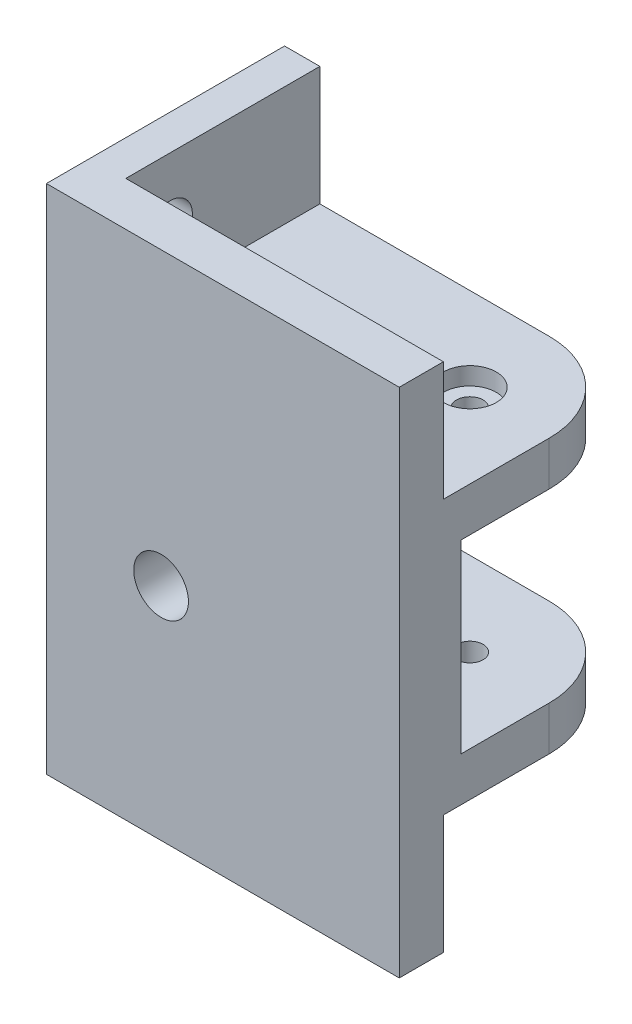
from build123d import *

# Parameters (mm, degrees)
EXTRUDE_1_DEPTH      = 58
SKETCH_2_R           = 3
CUT_EXTRUDE_1_DEPTH  = 58
SKETCH_3_W           = 15
SKETCH_3_H           = 14.5
SKETCH_3_W_2         = 25
CUT_EXTRUDE_2_DEPTH  = 22
SKETCH_5_W           = 4
SKETCH_5_H           = 14.5
EXTRUDE_2_DEPTH      = 22
CUT_EXTRUDE_3_DEPTH  = 22
CUT_EXTRUDE_START    = -30
CUT_EXTRUDE_4_DEPTH  = 30
EXTRUDE_START        = -4
EXTRUDE_5_DEPTH      = 4
EXTRUDE_6_DEPTH      = 4
SKETCH_18_R          = 3.05
CUT_EXTRUDE_7_DEPTH  = 50
SKETCH_17_R          = 1.51
CUT_EXTRUDE_8_DEPTH  = 50
EXTRUDE_7_DEPTH      = 4
EXTRUDE_START_2      = 1
SKETCH_20_R          = 1.51
EXTRUDE_8_DEPTH      = 1
SKETCH_21_R          = 3
SKETCH_21_R_2        = 1.51
CUT_EXTRUDE_9_DEPTH  = 2
EXTRUDE_9_DEPTH      = 4
SKETCH_23_R          = 1.51
EXTRUDE_10_DEPTH     = 1
CUT_EXTRUDE_START_2  = -2
SKETCH_24_R          = 3
CUT_EXTRUDE_10_DEPTH = 2
CUT_EXTRUDE_11_DEPTH = 100
SKETCH_26_R          = 3.05
EXTRUDE_11_DEPTH     = 27
SKETCH_27_R          = 3.1
CUT_EXTRUDE_12_DEPTH = 27
SKETCH_29_W          = 20
SKETCH_29_H          = 21
CUT_EXTRUDE_13_DEPTH = 20
EXTRUDE_START_3      = -5
SKETCH_30_R          = 3
EXTRUDE_12_DEPTH     = 5
SKETCH_32_R          = 3
EXTRUDE_13_DEPTH     = 5
SKETCH_34_R          = 1.51
CUT_EXTRUDE_14_DEPTH = 100
SKETCH_35_R          = 3
CUT_EXTRUDE_15_DEPTH = 2
SKETCH_36_R          = 3
CUT_EXTRUDE_16_DEPTH = 2


with BuildPart() as part:
    # 草图1 → 凸台-拉伸1 (new body)
    with BuildSketch(Plane(origin=(0, 0, 0), x_dir=(1, 0, 0), z_dir=(0, 1, 0))):
        with BuildLine():
            Line((-20, 13.5), (5, 13.5))
            ThreePointArc((5, 13.5), (15.606601718, 9.106601718), (20, -1.5))
            Line((20, -1.5), (20, -13.5))
            Line((20, -13.5), (-20, -13.5))
            Line((-20, -13.5), (-20, 13.5))
        make_face()
    extrude(amount=EXTRUDE_1_DEPTH)

    # 草图2 → 切除-拉伸1 (cut)
    with BuildSketch(Plane.XY.offset(13.5)):
        with Locations((-7, 33)):
            Circle(SKETCH_2_R)
    extrude(amount=-CUT_EXTRUDE_1_DEPTH, mode=Mode.SUBTRACT)

    # 草图3 → 切除-拉伸2 (cut)
    with BuildSketch(Plane(origin=(0, 0, -13.5), x_dir=(-1, 0, 0), z_dir=(0, 0, -1))):
        with Locations((-12.5, 50.75)):
            Rectangle(SKETCH_3_W, SKETCH_3_H)
        with Locations((-12.5, 7.25)):
            Rectangle(SKETCH_3_W, SKETCH_3_H)
        with Locations((7.5, 7.25)):
            Rectangle(SKETCH_3_W_2, SKETCH_3_H)
        with Locations((7.5, 50.75)):
            Rectangle(SKETCH_3_W_2, SKETCH_3_H)
    extrude(amount=-CUT_EXTRUDE_2_DEPTH, mode=Mode.SUBTRACT)

    # 草图5 → 凸台-拉伸2 (add)
    with BuildSketch(Plane(origin=(0, 0, 8.5), x_dir=(-1, 0, 0), z_dir=(0, 0, -1))):
        with Locations((18, 7.25)):
            Rectangle(SKETCH_5_W, SKETCH_5_H)
        with Locations((18, 50.75)):
            Rectangle(SKETCH_5_W, SKETCH_5_H)
    extrude(amount=EXTRUDE_2_DEPTH)

    # 草图8 → 切除-拉伸3 (cut)
    with BuildSketch(Plane.ZY.offset(20)):
        with BuildLine():
            ThreePointArc((6.05, 50.75), (5.303122292, 52.553122292), (3.5, 53.3))
            Line((3.5, 53.3), (3.5, 48.2))
            ThreePointArc((3.5, 48.2), (5.303122292, 48.946877708), (6.05, 50.75))
        make_face()
        with BuildLine():
            Line((3.5, 48.2), (3.5, 53.3))
            ThreePointArc((3.5, 53.3), (0.95, 50.75), (3.5, 48.2))
        make_face()
        with BuildLine():
            ThreePointArc((3.5, 9.8), (0.95, 7.25), (3.5, 4.7))
            Line((3.5, 4.7), (3.5, 9.8))
        make_face()
        with BuildLine():
            Line((3.5, 9.8), (3.5, 4.7))
            ThreePointArc((3.5, 4.7), (5.303122292, 5.446877708), (6.05, 7.25))
            ThreePointArc((6.05, 7.25), (5.303122292, 9.053122292), (3.5, 9.8))
        make_face()
    extrude(amount=-CUT_EXTRUDE_3_DEPTH, mode=Mode.SUBTRACT)

    # 草图10 → 切除-拉伸4 (cut)
    with BuildSketch(Plane(origin=(0, 43.5, 0), x_dir=(1, 0, 0), z_dir=(0, 1, 0)).offset(CUT_EXTRUDE_START)):
        with BuildLine():
            Line((20, -6.5), (20, -1.5))
            ThreePointArc((20, -1.5), (15.606601718, 9.106601718), (5, 13.5))
            Line((5, 13.5), (0, 13.5))
            ThreePointArc((0, 13.5), (5.857864376, -0.642135624), (20, -6.5))
        make_face()
        with BuildLine():
            Line((20, -1.5), (20, 13.5))
            Line((20, 13.5), (5, 13.5))
            ThreePointArc((5, 13.5), (15.606601718, 9.106601718), (20, -1.5))
        make_face()
    extrude(amount=CUT_EXTRUDE_4_DEPTH, mode=Mode.SUBTRACT)

    # 草图11 → 凸台-拉伸5 (add)
    with BuildSketch(Plane(origin=(0, 43.5, 0), x_dir=(1, 0, 0), z_dir=(0, 1, 0)).offset(EXTRUDE_START)):
        with BuildLine():
            Line((5, 13.5), (0, 13.5))
            ThreePointArc((0, 13.5), (5.857864376, -0.642135624), (20, -6.5))
            Line((20, -6.5), (20, -1.5))
            ThreePointArc((20, -1.5), (15.606601718, 9.106601718), (5, 13.5))
        make_face()
    extrude(amount=EXTRUDE_5_DEPTH)

    # 草图13 → 凸台-拉伸6 (add)
    with BuildSketch(Plane.XZ.offset(-14.5)):
        with BuildLine():
            Line((0, -13.5), (5, -13.5))
            ThreePointArc((5, -13.5), (15.606601718, -9.106601718), (20, 1.5))
            Line((20, 1.5), (20, 6.5))
            ThreePointArc((20, 6.5), (5.857864376, 0.642135624), (0, -13.5))
        make_face()
    extrude(amount=-EXTRUDE_6_DEPTH)

    # 草图18 → 切除-拉伸7 (cut)
    with BuildSketch(Plane.XY.offset(13.5)):
        with Locations((-7, 33)):
            Circle(SKETCH_18_R)
    extrude(amount=-CUT_EXTRUDE_7_DEPTH, mode=Mode.SUBTRACT)

    # 草图17 → 切除-拉伸8 (cut)
    with BuildSketch(Plane(origin=(0, 43.5, 0), x_dir=(1, 0, 0), z_dir=(0, 1, 0))):
        with Locations(Location((12.928932188, 6.428932188, 0), (0, 0, 270))):
            Circle(SKETCH_17_R)
    extrude(amount=-CUT_EXTRUDE_8_DEPTH, mode=Mode.SUBTRACT)

    # 草图19 → 凸台-拉伸7 (add)
    with BuildSketch(Plane(origin=(0, 43.5, 0), x_dir=(1, 0, 0), z_dir=(0, 1, 0)).offset(EXTRUDE_START)):
        with BuildLine():
            Line((10, 13.5), (5, 13.5))
            ThreePointArc((5, 13.5), (15.606601718, 9.106601718), (20, -1.5))
            Line((20, -1.5), (20, 3.5))
            ThreePointArc((20, 3.5), (17.071067812, 10.571067812), (10, 13.5))
        make_face()
    extrude(amount=EXTRUDE_7_DEPTH)

    # 草图20 → 凸台-拉伸8 (add)
    with BuildSketch(Plane(origin=(0, 43.5, 0), x_dir=(1, 0, 0), z_dir=(0, 1, 0)).offset(EXTRUDE_START_2)):
        with BuildLine():
            Line((20, 3.5), (20, -8.5))
            Line((20, -8.5), (-16, -8.5))
            Line((-16, -8.5), (-16, 13.5))
            Line((-16, 13.5), (10, 13.5))
            ThreePointArc((10, 13.5), (17.071067812, 10.571067812), (20, 3.5))
        make_face()
        with Locations(Location((12.928932188, 6.428932188, 0), (0, 0, 270))):
            Circle(SKETCH_20_R, mode=Mode.SUBTRACT)
    extrude(amount=-EXTRUDE_8_DEPTH)

    # 草图21 → 切除-拉伸9 (cut)
    with BuildSketch(Plane(origin=(0, 44.5, 0), x_dir=(1, 0, 0), z_dir=(0, 1, 0))):
        with Locations(Location((12.928932188, 6.428932188, 0), (0, 0, 270))):
            Circle(SKETCH_21_R)
        with Locations(Location((12.928932188, 6.428932188, 0), (0, 0, 270))):
            Circle(SKETCH_21_R_2, mode=Mode.SUBTRACT)
    extrude(amount=-CUT_EXTRUDE_9_DEPTH, mode=Mode.SUBTRACT)

    # 草图22 → 凸台-拉伸9 (add)
    with BuildSketch(Plane(origin=(0, 14.5, 0), x_dir=(-1, 0, 0), z_dir=(0, -1, 0))):
        with BuildLine():
            Line((-5, 13.5), (-10, 13.5))
            ThreePointArc((-10, 13.5), (-17.071067812, 10.571067812), (-20, 3.5))
            Line((-20, 3.5), (-20, -1.5))
            ThreePointArc((-20, -1.5), (-15.606601718, 9.106601718), (-5, 13.5))
        make_face()
    extrude(amount=-EXTRUDE_9_DEPTH)

    # 草图23 → 凸台-拉伸10 (add)
    with BuildSketch(Plane(origin=(0, 14.5, 0), x_dir=(-1, 0, 0), z_dir=(0, -1, 0))):
        with BuildLine():
            Line((16, -8.5), (16, 13.5))
            Line((16, 13.5), (-10, 13.5))
            ThreePointArc((-10, 13.5), (-17.071067812, 10.571067812), (-20, 3.5))
            Line((-20, 3.5), (-20, -8.5))
            Line((-20, -8.5), (16, -8.5))
        make_face()
        with Locations(Location((-12.928932188, 6.428932188, 0), (0, 0, 270))):
            Circle(SKETCH_23_R, mode=Mode.SUBTRACT)
    extrude(amount=EXTRUDE_10_DEPTH)

    # 草图24 → 切除-拉伸10 (cut)
    with BuildSketch(Plane(origin=(0, 13.5, 0), x_dir=(-1, 0, 0), z_dir=(0, -1, 0)).offset(CUT_EXTRUDE_START_2)):
        with Locations(Location((-12.928932188, 6.428932188, 0), (0, 0, 270))):
            Circle(SKETCH_24_R)
    extrude(amount=CUT_EXTRUDE_10_DEPTH, mode=Mode.SUBTRACT)

    # 草图25 → 切除-拉伸11 (cut)
    with BuildSketch(Plane.XY.offset(13.5)):
        with BuildLine():
            ThreePointArc((-3.95, 25), (-4.843324317, 27.156675683), (-7, 28.05))
            Line((-7, 28.05), (-7, 21.95))
            ThreePointArc((-7, 21.95), (-4.843324317, 22.843324317), (-3.95, 25))
        make_face()
        with BuildLine():
            Line((-7, 21.95), (-7, 28.05))
            ThreePointArc((-7, 28.05), (-10.05, 25), (-7, 21.95))
        make_face()
    extrude(amount=-CUT_EXTRUDE_11_DEPTH, mode=Mode.SUBTRACT)

    # 草图26 → 凸台-拉伸11 (add)
    with BuildSketch(Plane.XY.offset(13.5)):
        with Locations((-7, 33)):
            Circle(SKETCH_26_R)
    extrude(amount=-EXTRUDE_11_DEPTH)

    # 草图27 → 切除-拉伸12 (cut)
    with BuildSketch(Plane.XY.offset(13.5)):
        with Locations((-7, 25)):
            Circle(SKETCH_27_R)
    extrude(amount=-CUT_EXTRUDE_12_DEPTH, mode=Mode.SUBTRACT)

    # 草图29 → 切除-拉伸13 (cut)
    with BuildSketch(Plane(origin=(0, 0, -13.5), x_dir=(-1, 0, 0), z_dir=(0, 0, -1))):
        with Locations((-10, 29)):
            Rectangle(SKETCH_29_W, SKETCH_29_H)
    extrude(amount=-CUT_EXTRUDE_13_DEPTH, mode=Mode.SUBTRACT)

    # 草图30 → 凸台-拉伸12 (add)
    with BuildSketch(Plane(origin=(0, 13.5, 0), x_dir=(-1, 0, 0), z_dir=(0, -1, 0)).offset(EXTRUDE_START_3)):
        with Locations(Location((-12.928932188, 6.428932188, 0), (0, 0, 270))):
            Circle(SKETCH_30_R)
    extrude(amount=EXTRUDE_12_DEPTH)

    # 草图32 → 凸台-拉伸13 (add)
    with BuildSketch(Plane(origin=(0, 44.5, 0), x_dir=(1, 0, 0), z_dir=(0, 1, 0))):
        with Locations((12.928932188, 6.428932188)):
            Circle(SKETCH_32_R)
    extrude(amount=-EXTRUDE_13_DEPTH)

    # 草图34 → 切除-拉伸14 (cut)
    with BuildSketch(Plane(origin=(0, 44.5, 0), x_dir=(1, 0, 0), z_dir=(0, 1, 0))):
        with Locations(Location((10.5, 4, 0), (0, 0, 270))):
            Circle(SKETCH_34_R)
    extrude(amount=-CUT_EXTRUDE_14_DEPTH, mode=Mode.SUBTRACT)

    # 草图35 → 切除-拉伸15 (cut)
    with BuildSketch(Plane(origin=(0, 44.5, 0), x_dir=(1, 0, 0), z_dir=(0, 1, 0))):
        with Locations(Location((10.5, 4, 0), (0, 0, 270))):
            Circle(SKETCH_35_R)
    extrude(amount=-CUT_EXTRUDE_15_DEPTH, mode=Mode.SUBTRACT)

    # 草图36 → 切除-拉伸16 (cut)
    with BuildSketch(Plane(origin=(0, 13.5, 0), x_dir=(-1, 0, 0), z_dir=(0, -1, 0)).offset(CUT_EXTRUDE_START_2)):
        with Locations(Location((-10.5, 4, 0), (0, 0, 270))):
            Circle(SKETCH_36_R)
    extrude(amount=CUT_EXTRUDE_16_DEPTH, mode=Mode.SUBTRACT)


solid = part.part
